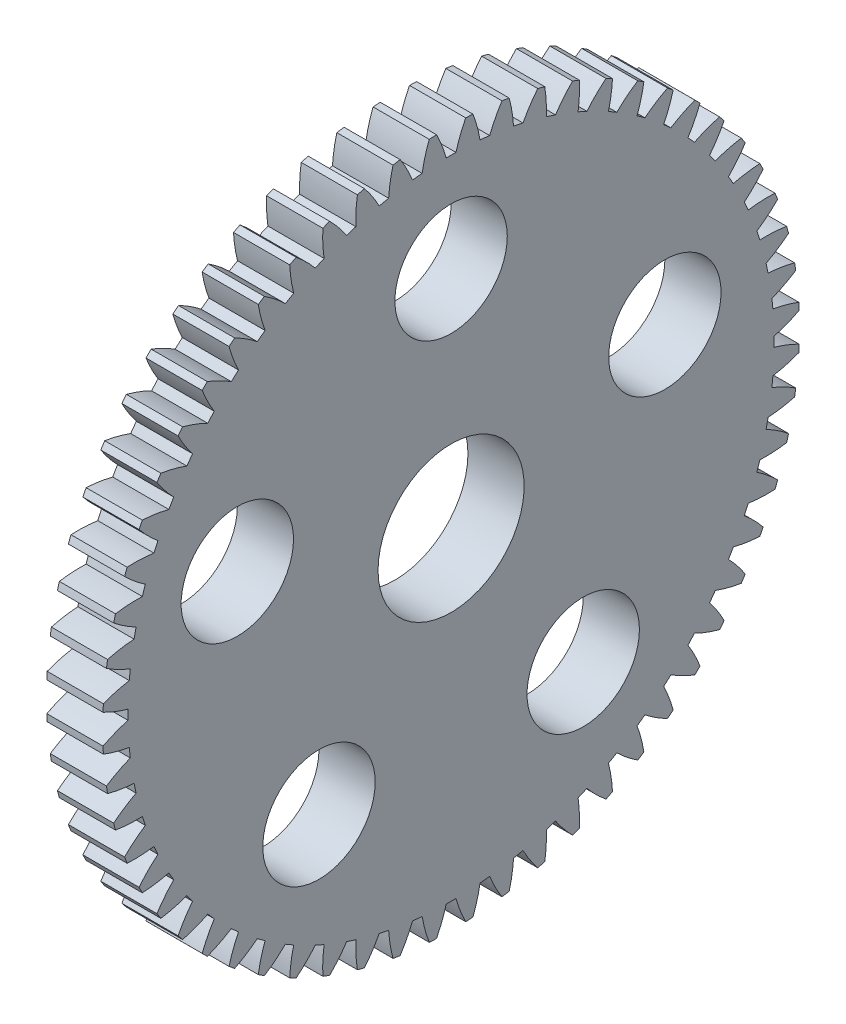
from build123d import *

# Parameters (mm, degrees)
BASPROSKE_W         = 5
BASPROSKE_H         = 31
TOOTHCUT_DEPTH      = 45.124822946
TEETHCUTS_COUNT     = 60
BORSKE_R            = 6.5
BORE_DEPTH          = 50.0000508
SKETCH_1_R          = 5
CUT_EXTRUDE_2_DEPTH = 5


with BuildPart() as part:
    # BasProSke → Base-Revolve (revolve)
    with BuildSketch(Plane(origin=(0, 0, 0), x_dir=(1, 0, 0), z_dir=(0, 1, 0)), mode=Mode.PRIVATE) as base_revolve_sk:
        with Locations((2.5, 15.5)):
            Rectangle(BASPROSKE_W, BASPROSKE_H)
    revolve(base_revolve_sk.sketch.rotate(Axis((-10, 0, 0), (1, 0, 0)), 180), axis=Axis((-10, 0, 0), (1, 0, 0)))

    # TooCutSke → ToothCut (cut, through all)
    with BuildSketch(Plane(origin=(0, 0, 0), x_dir=(0, 0, -1), z_dir=(1, 0, 0))):
        with BuildLine():
            ThreePointArc((0.430151971, 28.745781782), (0, 28.749), (-0.430151971, 28.745781782))
            ThreePointArc((-0.430151971, 28.745781782), (-0.81454129, 29.893990802), (-1.312684569, 30.997617721))
            ThreePointArc((-1.312684569, 30.997617721), (0, 31.0254), (1.312684569, 30.997617721))
            ThreePointArc((1.312684569, 30.997617721), (0.81454129, 29.893990802), (0.430151971, 28.745781782))
        make_face()
    toothcut = extrude(amount=TOOTHCUT_DEPTH, mode=Mode.SUBTRACT)

    # TeethCuts: ToothCut ×60 about axis
    teethcuts_axis = Axis((0, 0, 0), (1, 0, 0))
    for i in range(1, TEETHCUTS_COUNT):
        add(toothcut.rotate(teethcuts_axis, i * 360 / TEETHCUTS_COUNT), mode=Mode.SUBTRACT)

    # BorSke → Bore (cut, symmetric)
    with BuildSketch(Plane(origin=(0, 0, 0), x_dir=(0, 0, -1), z_dir=(1, 0, 0))):
        with Locations(Location((0, 0, 0), (0, 0, 180))):
            Circle(BORSKE_R)
    extrude(amount=BORE_DEPTH, both=True, mode=Mode.SUBTRACT)

    # 草图1 → 切除-拉伸2 (cut)
    with BuildSketch(Plane(origin=(5, 0, 0), x_dir=(0, 0, -1), z_dir=(1, 0, 0))):
        with Locations((0, 20)):
            Circle(SKETCH_1_R)
        with Locations((19.021130326, 6.180339887)):
            Circle(SKETCH_1_R)
        with Locations((11.755705046, -16.180339887)):
            Circle(SKETCH_1_R)
        with Locations((-11.755705046, -16.180339887)):
            Circle(SKETCH_1_R)
        with Locations((-19.021130326, 6.180339887)):
            Circle(SKETCH_1_R)
    extrude(amount=-CUT_EXTRUDE_2_DEPTH, mode=Mode.SUBTRACT)


solid = part.part
